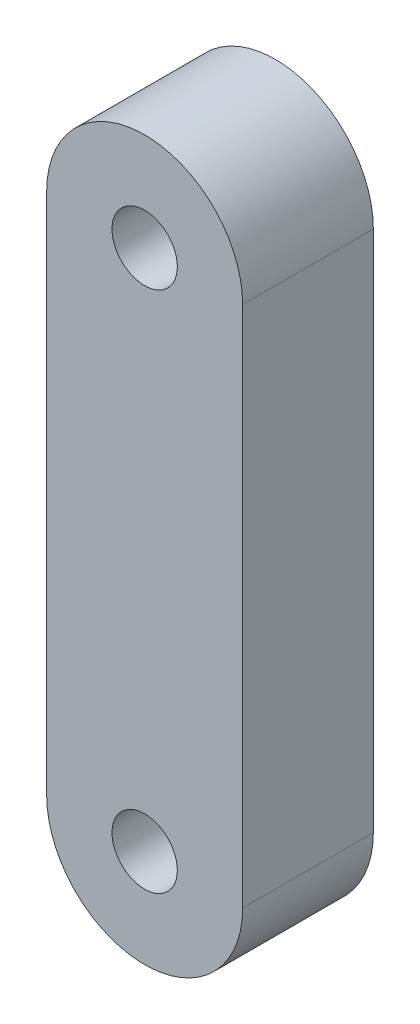
from build123d import *

# Parameters (mm, degrees)
ESQUISSE1_R        = 0.5
BOSS_EXTRU_1_DEPTH = 2


with BuildPart() as part:
    # Esquisse1 → Boss.-Extru.1 (new body)
    with BuildSketch(Plane.XY):
        with BuildLine():
            Line((-1.5, 9), (-1.5, 1))
            ThreePointArc((-1.5, 1), (0, -0.5), (1.5, 1))
            Line((1.5, 1), (1.5, 9))
            ThreePointArc((1.5, 9), (0, 10.5), (-1.5, 9))
        make_face()
        with Locations((0, 1)):
            Circle(ESQUISSE1_R, mode=Mode.SUBTRACT)
        with Locations((0, 9)):
            Circle(ESQUISSE1_R, mode=Mode.SUBTRACT)
    extrude(amount=BOSS_EXTRU_1_DEPTH)


solid = part.part
